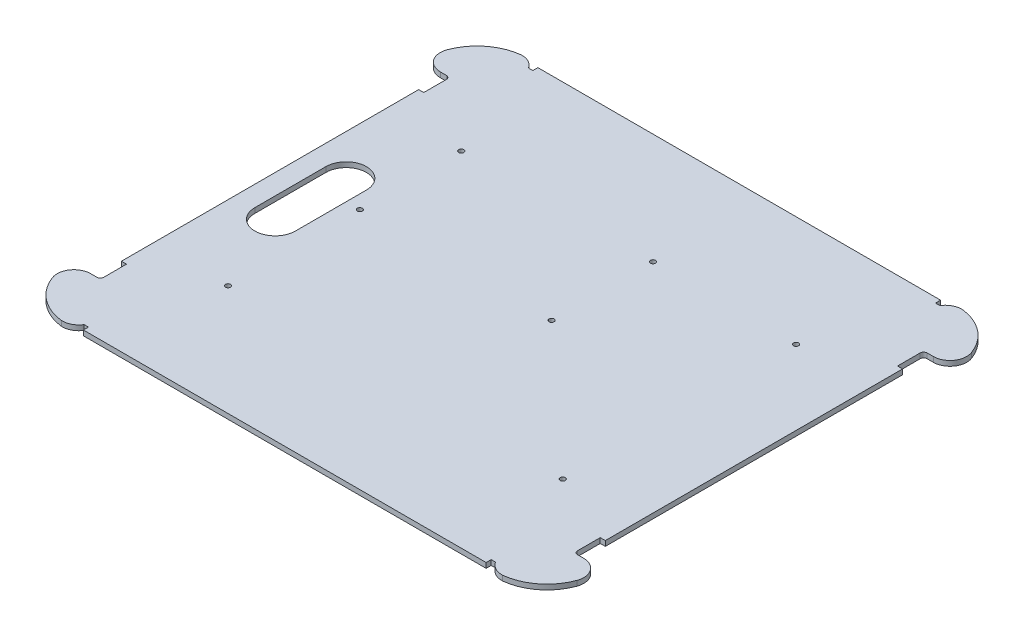
from build123d import *

# Parameters (mm, degrees)
BOSS_EXTRUDE1_DEPTH = 5
SKETCH4_R           = 2.5
CUT_EXTRUDE1_DEPTH  = 20
CUT_EXTRUDE2_DEPTH  = 10
SKETCH8_R           = 2.5
CUT_EXTRUDE3_DEPTH  = 10


with BuildPart() as part:
    # Sketch1 → Boss-Extrude1 (new body)
    with BuildSketch(Plane(origin=(0, 0, 0), x_dir=(1, 0, 0), z_dir=(0, 1, 0))):
        with BuildLine():
            Line((-279.827757823, 163.191662052), (-273.826637764, 163.191662052))
            ThreePointArc((-273.826637764, 163.191662052), (-271.35176403, 162.166535786), (-270.326637764, 159.691662052))
            Line((-270.326637764, 159.691662052), (-270.326637764, 137.406790352))
            Line((-270.326637764, 137.406790352), (-275.326637764, 137.406790352))
            Line((-275.326637764, 137.406790352), (-275.326637764, -155.644744292))
            Line((-275.326637764, -155.644744292), (-270.326637764, -155.644744292))
            Line((-270.326637764, -155.644744292), (-270.326637764, -177.929615992))
            ThreePointArc((-270.326637764, -177.929615992), (-271.35176403, -180.404489727), (-273.826637764, -181.429615992))
            Line((-273.826637764, -181.429615992), (-279.827757823, -181.429615992))
            ThreePointArc((-279.827757823, -181.429615992), (-293.34742446, -188.470830973), (-295.328317853, -203.584935503))
            ThreePointArc((-295.328317853, -203.584935503), (-279.434102169, -225.521844766), (-254.372898367, -235.807278357))
            ThreePointArc((-254.372898367, -235.807278357), (-245.944078079, -233.964230965), (-239.597831877, -228.11897697))
            Line((-239.597831877, -228.11897697), (-235.326637764, -228.11897697))
            Line((-235.326637764, -228.11897697), (-235.326637764, -233.11897697))
            Line((-235.326637764, -233.11897697), (161.673362236, -233.11897697))
            Line((161.673362236, -233.11897697), (161.673362236, -228.11897697))
            Line((161.673362236, -228.11897697), (165.944556349, -228.11897697))
            ThreePointArc((165.944556349, -228.11897697), (172.290802551, -233.964230965), (180.719622838, -235.807278357))
            ThreePointArc((180.719622838, -235.807278357), (205.780826641, -225.521844766), (221.675042324, -203.584935503))
            ThreePointArc((221.675042324, -203.584935503), (219.694148932, -188.470830973), (206.174482295, -181.429615992))
            Line((206.174482295, -181.429615992), (200.173362236, -181.429615992))
            ThreePointArc((200.173362236, -181.429615992), (197.698488502, -180.404489727), (196.673362236, -177.929615992))
            Line((196.673362236, -177.929615992), (196.673362236, -155.644744292))
            Line((196.673362236, -155.644744292), (201.673362236, -155.644744292))
            Line((201.673362236, -155.644744292), (201.673362236, 137.406790352))
            Line((201.673362236, 137.406790352), (196.673362236, 137.406790352))
            Line((196.673362236, 137.406790352), (196.673362236, 159.691662052))
            ThreePointArc((196.673362236, 159.691662052), (197.698488502, 162.166535786), (200.173362236, 163.191662052))
            Line((200.173362236, 163.191662052), (206.174482295, 163.191662052))
            ThreePointArc((206.174482295, 163.191662052), (219.694148932, 170.232877033), (221.675042324, 185.346981563))
            ThreePointArc((221.675042324, 185.346981563), (205.780826641, 207.283890825), (180.719622838, 217.569324417))
            ThreePointArc((180.719622838, 217.569324417), (172.290802551, 215.726277025), (165.944556349, 209.88102303))
            Line((165.944556349, 209.88102303), (161.673362236, 209.88102303))
            Line((161.673362236, 209.88102303), (161.673362236, 214.88102303))
            Line((161.673362236, 214.88102303), (-235.326637764, 214.88102303))
            Line((-235.326637764, 214.88102303), (-235.326637764, 209.88102303))
            Line((-235.326637764, 209.88102303), (-239.597831877, 209.88102303))
            ThreePointArc((-239.597831877, 209.88102303), (-245.944078079, 215.726277025), (-254.372898367, 217.569324417))
            ThreePointArc((-254.372898367, 217.569324417), (-279.434102169, 207.283890825), (-295.328317853, 185.346981563))
            ThreePointArc((-295.328317853, 185.346981563), (-293.34742446, 170.232877033), (-279.827757823, 163.191662052))
        make_face()
    extrude(amount=BOSS_EXTRUDE1_DEPTH)

    # Sketch4 → Cut-Extrude1 (cut)
    with BuildSketch(Plane.XZ):
        with Locations(Location((-201.826637764, 124.11897697, 0), (0, 0, 270))):
            Circle(SKETCH4_R)
        with Locations(Location((-201.826637764, -105.88102303, 0), (0, 0, 90))):
            Circle(SKETCH4_R)
        with Locations(Location((128.173362236, -105.88102303, 0), (0, 0, 270))):
            Circle(SKETCH4_R)
        with Locations(Location((128.173362236, 124.11897697, 0), (0, 0, 90))):
            Circle(SKETCH4_R)
    extrude(amount=-CUT_EXTRUDE1_DEPTH, mode=Mode.SUBTRACT)

    # Sketch5 → Cut-Extrude2 (cut)
    with BuildSketch(Plane(origin=(0, 5, 0), x_dir=(1, 0, 0), z_dir=(0, 1, 0))):
        with BuildLine():
            Line((-255.326637764, -44.11897697), (-255.326637764, 25.88102303))
            ThreePointArc((-255.326637764, 25.88102303), (-235.326637764, 45.88102303), (-215.326637764, 25.88102303))
            Line((-215.326637764, 25.88102303), (-215.326637764, -44.11897697))
            ThreePointArc((-215.326637764, -44.11897697), (-235.326637764, -64.11897697), (-255.326637764, -44.11897697))
        make_face()
    extrude(amount=-CUT_EXTRUDE2_DEPTH, mode=Mode.SUBTRACT)

    # Sketch8 → Cut-Extrude3 (cut)
    with BuildSketch(Plane.XZ):
        with Locations(Location((-201.826637764, -105.88102303, 0), (0, 0, 90))):
            Circle(SKETCH8_R)
        with Locations(Location((-201.826637764, -5.88102303, 0), (0, 0, 270))):
            Circle(SKETCH8_R)
        with Locations(Location((-12.826637764, -5.88102303, 0), (0, 0, 270))):
            Circle(SKETCH8_R)
        with Locations(Location((-12.826637764, -105.88102303, 0), (0, 0, 270))):
            Circle(SKETCH8_R)
    extrude(amount=-CUT_EXTRUDE3_DEPTH, mode=Mode.SUBTRACT)


solid = part.part
